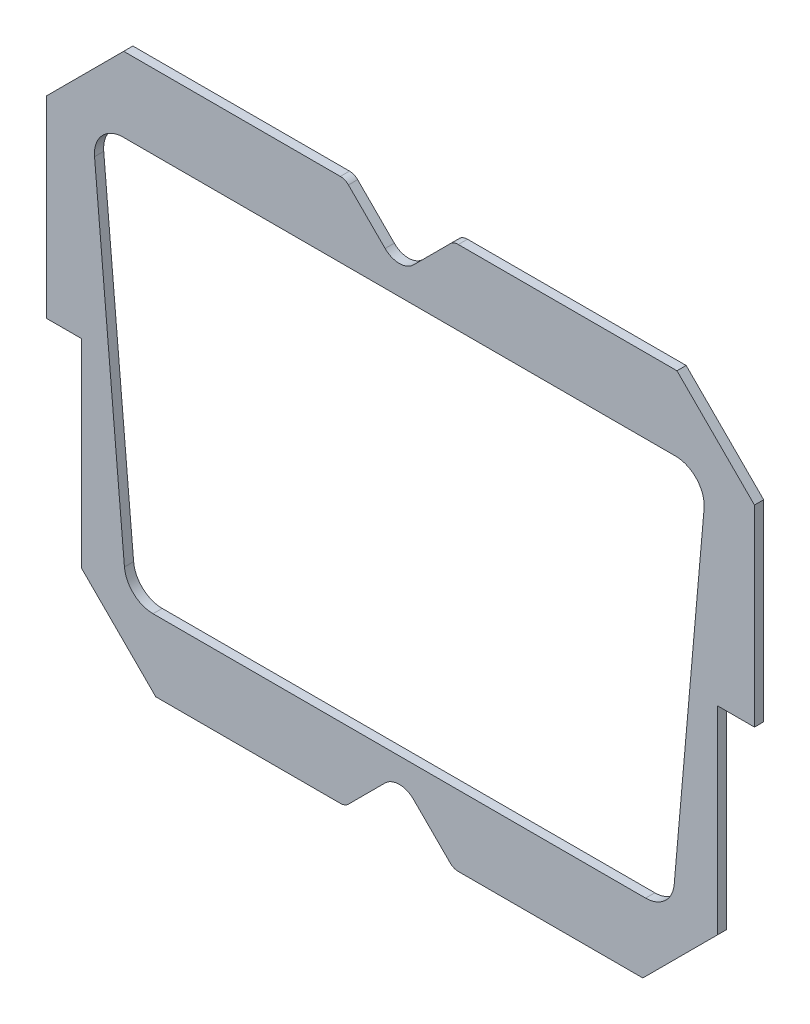
from build123d import *

# Parameters (mm, degrees)
EXTRUSION1_DEPTH = 1.6


with BuildPart() as part:
    # Esquisse1 → Extrusion1 (new body)
    with BuildSketch(Plane.XY):
        with BuildLine():
            Line((-48.023369217, 96.349184509), (-10.278174593, 96.349184509))
            ThreePointArc((-10.278174593, 96.349184509), (-9.512807728, 96.196943574), (-8.863961031, 95.763398071))
            Line((-8.863961031, 95.763398071), (-2.474873734, 89.374310774))
            ThreePointArc((-2.474873734, 89.374310774), (0, 88.349184509), (2.474873734, 89.374310774))
            Line((2.474873734, 89.374310774), (8.863961031, 95.763398071))
            ThreePointArc((8.863961031, 95.763398071), (9.512807728, 96.196943574), (10.278174593, 96.349184509))
            Line((10.278174593, 96.349184509), (48.369947474, 96.349184509))
            Line((48.369947474, 96.349184509), (61.879867656, 82.839264327))
            Line((61.879867656, 82.839264327), (61.879867656, 49.32839662))
            Line((61.879867656, 49.32839662), (55.4, 49.32839662))
            Line((55.4, 49.32839662), (55.4, 14.727514678))
            Line((55.4, 14.727514678), (42.421669831, 1.749184509))
            Line((42.421669831, 1.749184509), (10.278174593, 1.749184509))
            ThreePointArc((10.278174593, 1.749184509), (9.512807728, 1.901425444), (8.863961031, 2.334970946))
            Line((8.863961031, 2.334970946), (2.474873734, 8.724058243))
            ThreePointArc((2.474873734, 8.724058243), (0, 9.749184509), (-2.474873734, 8.724058243))
            Line((-2.474873734, 8.724058243), (-8.863961031, 2.334970946))
            ThreePointArc((-8.863961031, 2.334970946), (-9.512807728, 1.901425444), (-10.278174593, 1.749184509))
            Line((-10.278174593, 1.749184509), (-42.428554593, 1.749184509))
            Line((-42.428554593, 1.749184509), (-55.4, 14.720629916))
            Line((-55.4, 14.720629916), (-55.4, 49.32839662))
            Line((-55.4, 49.32839662), (-61.5, 49.32839662))
            Line((-61.5, 49.32839662), (-61.5, 82.872553726))
            Line((-61.5, 82.872553726), (-48.023369217, 96.349184509))
        make_face()
        with BuildLine():
            Line((-48.118530535, 83.349184509), (48.118530535, 83.349184509))
            ThreePointArc((48.118530535, 83.349184509), (51.805481915, 81.726519186), (53.099358035, 77.911740318))
            Line((53.099358035, 77.911740318), (47.891299628, 18.611740318))
            ThreePointArc((47.891299628, 18.611740318), (46.287806806, 15.362233129), (42.910472129, 14.049184509))
            Line((42.910472129, 14.049184509), (-42.910472129, 14.049184509))
            ThreePointArc((-42.910472129, 14.049184509), (-46.287806806, 15.362233129), (-47.891299628, 18.611740318))
            Line((-47.891299628, 18.611740318), (-53.099358035, 77.911740318))
            ThreePointArc((-53.099358035, 77.911740318), (-51.805481915, 81.726519186), (-48.118530535, 83.349184509))
        make_face(mode=Mode.SUBTRACT)
    extrude(amount=EXTRUSION1_DEPTH)


solid = part.part
